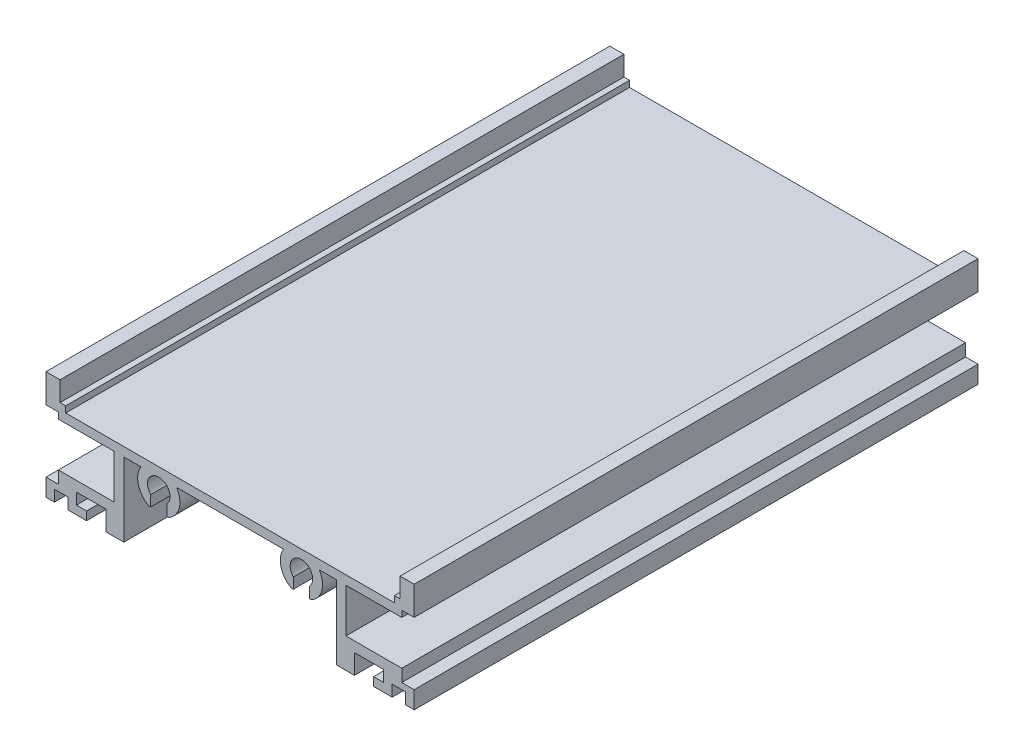
from build123d import *

# Parameters (mm, degrees)
ESTRUSIONE_ESTRUSIONE1_DEPTH = 100


with BuildPart() as part:
    # Schizzo1 → Estrusione-Estrusione1 (new body)
    with BuildSketch(Plane.XY):
        with BuildLine():
            Line((-30.15, 14), (-32.65, 14))
            Line((-32.65, 14), (-32.65, 8.9))
            Line((-32.65, 8.9), (-30.45, 8.9))
            Line((-30.45, 8.9), (-30.45, 7.8))
            Line((-30.45, 7.8), (-20.55, 7.8))
            Line((-20.55, 7.8), (-20.55, 0))
            Line((-20.55, 0), (-30.45, 0))
            Line((-30.45, 0), (-30.45, -2.2))
            Line((-30.45, -2.2), (-32.65, -2.2))
            Line((-32.65, -2.2), (-32.65, -5.3))
            Line((-32.65, -5.3), (-31.15, -5.3))
            Line((-31.15, -5.3), (-31.15, -3.3))
            Line((-31.15, -3.3), (-28.75, -3.3))
            Line((-28.75, -3.3), (-28.75, -5.3))
            Line((-28.75, -5.3), (-25.45, -5.3))
            Line((-25.45, -5.3), (-25.45, -3.8))
            Line((-25.45, -3.8), (-27.25, -3.8))
            Line((-27.25, -3.8), (-27.25, -1.8))
            Line((-27.25, -1.8), (-22.05, -1.8))
            Line((-22.05, -1.8), (-22.05, -5.3))
            Line((-22.05, -5.3), (-18.85, -5.3))
            Line((-18.85, -5.3), (-18.85, 7.8))
            Line((-18.85, 7.8), (-15.821542758, 7.8))
            ThreePointArc((-15.821542758, 7.8), (-16.273540604, 4.846345824), (-14.423395659, 2.5))
            Line((-14.423395659, 2.5), (-14.074102014, 2.5))
            Line((-14.074102014, 2.5), (-14.074102014, 4.405182935))
            ThreePointArc((-14.074102014, 4.405182935), (-12.647585955, 7.8), (-11.221069895, 4.405182935))
            Line((-11.221069895, 4.405182935), (-11.221069895, 2.5))
            Line((-11.221069895, 2.5), (-10.87177625, 2.5))
            ThreePointArc((-10.87177625, 2.5), (-9.021631305, 4.846345824), (-9.473629151, 7.8))
            Line((-9.473629151, 7.8), (0, 7.8))
            Line((0, 7.8), (0, 9.4))
            Line((0, 9.4), (-29.15, 9.4))
            Line((-29.15, 9.4), (-29.15, 10.5))
            Line((-29.15, 10.5), (-30.15, 10.5))
            Line((-30.15, 10.5), (-30.15, 14))
        make_face()
        with BuildLine():
            Line((29.15, 9.4), (0, 9.4))
            Line((0, 9.4), (0, 7.8))
            Line((0, 7.8), (9.473629151, 7.8))
            ThreePointArc((9.473629151, 7.8), (9.021631305, 4.846345824), (10.87177625, 2.5))
            Line((10.87177625, 2.5), (11.221069895, 2.5))
            Line((11.221069895, 2.5), (11.221069895, 4.405182935))
            ThreePointArc((11.221069895, 4.405182935), (12.647585955, 7.8), (14.074102014, 4.405182935))
            Line((14.074102014, 4.405182935), (14.074102014, 2.5))
            Line((14.074102014, 2.5), (14.423395659, 2.5))
            ThreePointArc((14.423395659, 2.5), (16.273540604, 4.846345824), (15.821542758, 7.8))
            Line((15.821542758, 7.8), (18.85, 7.8))
            Line((18.85, 7.8), (18.85, -5.3))
            Line((18.85, -5.3), (22.05, -5.3))
            Line((22.05, -5.3), (22.05, -1.8))
            Line((22.05, -1.8), (27.25, -1.8))
            Line((27.25, -1.8), (27.25, -3.8))
            Line((27.25, -3.8), (25.45, -3.8))
            Line((25.45, -3.8), (25.45, -5.3))
            Line((25.45, -5.3), (28.75, -5.3))
            Line((28.75, -5.3), (28.75, -3.3))
            Line((28.75, -3.3), (31.15, -3.3))
            Line((31.15, -3.3), (31.15, -5.3))
            Line((31.15, -5.3), (32.65, -5.3))
            Line((32.65, -5.3), (32.65, -2.2))
            Line((32.65, -2.2), (30.45, -2.2))
            Line((30.45, -2.2), (30.45, 0))
            Line((30.45, 0), (20.55, 0))
            Line((20.55, 0), (20.55, 7.8))
            Line((20.55, 7.8), (30.45, 7.8))
            Line((30.45, 7.8), (30.45, 8.9))
            Line((30.45, 8.9), (32.65, 8.9))
            Line((32.65, 8.9), (32.65, 14))
            Line((32.65, 14), (30.15, 14))
            Line((30.15, 14), (30.15, 10.5))
            Line((30.15, 10.5), (29.15, 10.5))
            Line((29.15, 10.5), (29.15, 9.4))
        make_face()
    extrude(amount=ESTRUSIONE_ESTRUSIONE1_DEPTH)


solid = part.part
